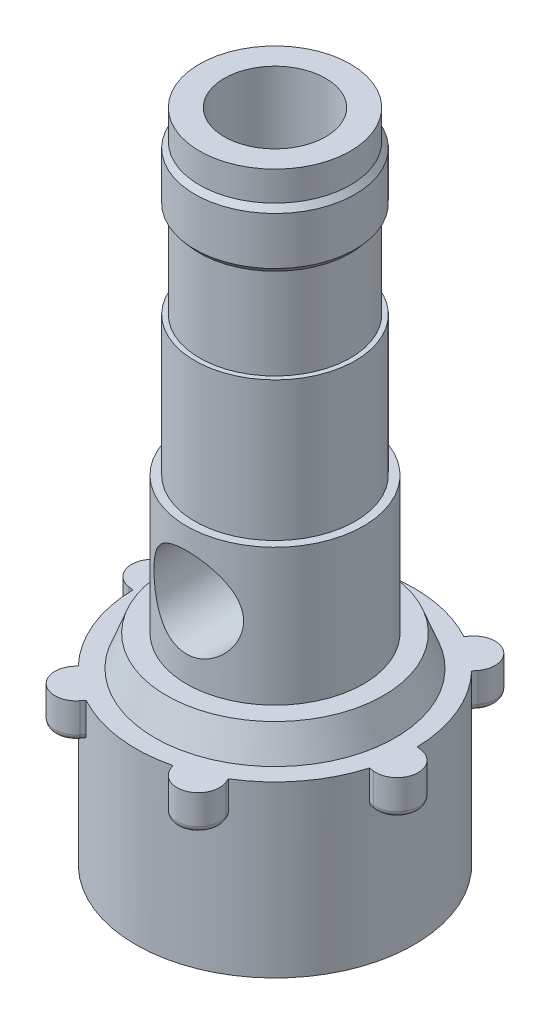
from build123d import *

# Parameters (mm, degrees)
CUT_EXTRUDE1_DEPTH              = 30.025161498
CUT_EXTRUDE1_DEPTH_BACK         = 30.025161498
SKETCH2_R                       = 1.9
BOSS_EXTRUDE3_DEPTH             = 1.5
FILLET1_RADIUS                  = 0.9
FILLET1_LENGTH                  = 1.5
FILLET2_R                       = 0.25
CIRPATTERN5_COUNT               = 6
FILLET1_OF_CIRPATTERN5_2_RADIUS = 0.9
FILLET1_OF_CIRPATTERN5_2_LENGTH = 1.5
FILLET1_OF_CIRPATTERN5_3_RADIUS = 0.9
FILLET1_OF_CIRPATTERN5_3_LENGTH = 1.5
FILLET1_OF_CIRPATTERN5_4_RADIUS = 0.9
FILLET1_OF_CIRPATTERN5_4_LENGTH = 1.5
FILLET1_OF_CIRPATTERN5_5_RADIUS = 0.9
FILLET1_OF_CIRPATTERN5_5_LENGTH = 1.5
FILLET1_OF_CIRPATTERN5_6_RADIUS = 0.9
FILLET1_OF_CIRPATTERN5_6_LENGTH = 1.5
FILLET3_R                       = 0.25


with BuildPart() as part:
    # Sketch1 → Revolve1 (revolve)
    with BuildSketch(Plane(origin=(0, 0, 0), x_dir=(0, 0, -1), z_dir=(1, 0, 0))):
        Polygon((0, 8), (3, 8), (3, 6), (5, 6), (5, 3), (5.3, 0), (5.9, 0), (5.9, 7.2), (5.1, 7.2), (4.6, 8.5), (3.75, 8.5), (3.75, 14.3), (3.4, 14.3), (3.4, 20.2), (3.2, 20.2), (3.2, 24.05), (3.4, 24.288350719), (3.4, 26.311649281), (3.2, 26.55), (3.2, 27.8), (2.15, 27.8), (2.15, 18.4), (1.9, 18.4), (1.9, 11.4), (0, 11.4), align=None)
    revolve(axis=Axis((0, 0, 0), (0, 1, 0)))

    # Sketch2 → Cut-Extrude1 (cut, two sides: drawn at the far end of the back side and taken through both)
    with BuildSketch(Plane.XY.offset(-CUT_EXTRUDE1_DEPTH_BACK)):
        with Locations((0, 11.5)):
            Circle(SKETCH2_R)
    extrude(amount=CUT_EXTRUDE1_DEPTH + CUT_EXTRUDE1_DEPTH_BACK, mode=Mode.SUBTRACT)

    # Sketch6 → Boss-Extrude3 (add)
    with BuildSketch(Plane(origin=(0, 7.2, 0), x_dir=(1, 0, 0), z_dir=(0, 1, 0))):
        Polygon((-3.477462054, 6.043522717), (-3.030086713, 4.963463101), (-1.367103554, 5.652293279), (-1.814478896, 6.732352896), align=None)
    boss_extrude3 = extrude(amount=-BOSS_EXTRUDE3_DEPTH)

    # Fillet1: full round fillet: the end face becomes a half cylinder, R = half its width
    fillet1_face = Plane((-2.645970475, 6.45, -6.387937807), x_dir=(0, 1, 0), z_dir=(-0.382683432365, 0, -0.923879532511))  # on the end face: x along it, z out of the body
    fillet1_slab = fillet1_face.offset(-FILLET1_RADIUS / 2) * Box(FILLET1_LENGTH, 2 * FILLET1_RADIUS, FILLET1_RADIUS, mode=Mode.PRIVATE)  # the body's end, R deep
    fillet1_round = Plane((-2.301555386, 6.45, -5.556446228), x_dir=(-0.382683432365, 0, -0.923879532511), z_dir=(0, 1, 0)) * Cylinder(FILLET1_RADIUS, FILLET1_LENGTH, mode=Mode.PRIVATE)  # its axis R under the face
    add(fillet1_slab - fillet1_round, mode=Mode.SUBTRACT)

    # Fillet2
    fillet2_edges = [part.edges().sort_by_distance(p)[0] for p in [
        (-3.097973615, 5.7, -5.12735658),
        (-2.645970475, 5.7, -6.387937807),
        (-1.434990456, 5.7, -5.816186758),
    ]]
    fillet(fillet2_edges, radius=FILLET2_R)

    # CirPattern5: Boss-Extrude3 ×6 about axis
    cirpattern5_axis = Axis((0, 0, 0), (0, 1, 0))
    for i in range(1, CIRPATTERN5_COUNT):
        add(boss_extrude3.rotate(cirpattern5_axis, i * 360 / CIRPATTERN5_COUNT))

    # Fillet1 of CirPattern5 2: full round fillet: the end face becomes a half cylinder, R = half its width
    fillet1_of_cirpattern5_2_face = Plane((-6.855101656, 6.45, -0.902491254), x_dir=(0, 1, 0), z_dir=(-0.991444861374, 0, -0.13052619222))  # on the end face: x along it, z out of the body
    fillet1_of_cirpattern5_2_slab = fillet1_of_cirpattern5_2_face.offset(-FILLET1_OF_CIRPATTERN5_2_RADIUS / 2) * Box(FILLET1_OF_CIRPATTERN5_2_LENGTH, 2 * FILLET1_OF_CIRPATTERN5_2_RADIUS, FILLET1_OF_CIRPATTERN5_2_RADIUS, mode=Mode.PRIVATE)  # the body's end, R deep
    fillet1_of_cirpattern5_2_round = Plane((-5.962801281, 6.45, -0.785017681), x_dir=(-0.991444861374, 0, -0.13052619222), z_dir=(0, 1, 0)) * Cylinder(FILLET1_OF_CIRPATTERN5_2_RADIUS, FILLET1_OF_CIRPATTERN5_2_LENGTH, mode=Mode.PRIVATE)  # its axis R under the face
    add(fillet1_of_cirpattern5_2_slab - fillet1_of_cirpattern5_2_round, mode=Mode.SUBTRACT)

    # Fillet1 of CirPattern5 3: full round fillet: the end face becomes a half cylinder, R = half its width
    fillet1_of_cirpattern5_3_face = Plane((-4.209131181, 6.45, 5.485446553), x_dir=(0, 1, 0), z_dir=(-0.608761429009, 0, 0.793353340291))  # on the end face: x along it, z out of the body
    fillet1_of_cirpattern5_3_slab = fillet1_of_cirpattern5_3_face.offset(-FILLET1_OF_CIRPATTERN5_3_RADIUS / 2) * Box(FILLET1_OF_CIRPATTERN5_3_LENGTH, 2 * FILLET1_OF_CIRPATTERN5_3_RADIUS, FILLET1_OF_CIRPATTERN5_3_RADIUS, mode=Mode.PRIVATE)  # the body's end, R deep
    fillet1_of_cirpattern5_3_round = Plane((-3.661245895, 6.45, 4.771428547), x_dir=(-0.608761429009, 0, 0.793353340291), z_dir=(0, 1, 0)) * Cylinder(FILLET1_OF_CIRPATTERN5_3_RADIUS, FILLET1_OF_CIRPATTERN5_3_LENGTH, mode=Mode.PRIVATE)  # its axis R under the face
    add(fillet1_of_cirpattern5_3_slab - fillet1_of_cirpattern5_3_round, mode=Mode.SUBTRACT)

    # Fillet1 of CirPattern5 4: full round fillet: the end face becomes a half cylinder, R = half its width
    fillet1_of_cirpattern5_4_face = Plane((2.645970475, 6.45, 6.387937807), x_dir=(0, 1, 0), z_dir=(0.382683432365, 0, 0.923879532511))  # on the end face: x along it, z out of the body
    fillet1_of_cirpattern5_4_slab = fillet1_of_cirpattern5_4_face.offset(-FILLET1_OF_CIRPATTERN5_4_RADIUS / 2) * Box(FILLET1_OF_CIRPATTERN5_4_LENGTH, 2 * FILLET1_OF_CIRPATTERN5_4_RADIUS, FILLET1_OF_CIRPATTERN5_4_RADIUS, mode=Mode.PRIVATE)  # the body's end, R deep
    fillet1_of_cirpattern5_4_round = Plane((2.301555386, 6.45, 5.556446228), x_dir=(0.382683432365, 0, 0.923879532511), z_dir=(0, 1, 0)) * Cylinder(FILLET1_OF_CIRPATTERN5_4_RADIUS, FILLET1_OF_CIRPATTERN5_4_LENGTH, mode=Mode.PRIVATE)  # its axis R under the face
    add(fillet1_of_cirpattern5_4_slab - fillet1_of_cirpattern5_4_round, mode=Mode.SUBTRACT)

    # Fillet1 of CirPattern5 5: full round fillet: the end face becomes a half cylinder, R = half its width
    fillet1_of_cirpattern5_5_face = Plane((6.855101656, 6.45, 0.902491254), x_dir=(0, 1, 0), z_dir=(0.991444861374, 0, 0.13052619222))  # on the end face: x along it, z out of the body
    fillet1_of_cirpattern5_5_slab = fillet1_of_cirpattern5_5_face.offset(-FILLET1_OF_CIRPATTERN5_5_RADIUS / 2) * Box(FILLET1_OF_CIRPATTERN5_5_LENGTH, 2 * FILLET1_OF_CIRPATTERN5_5_RADIUS, FILLET1_OF_CIRPATTERN5_5_RADIUS, mode=Mode.PRIVATE)  # the body's end, R deep
    fillet1_of_cirpattern5_5_round = Plane((5.962801281, 6.45, 0.785017681), x_dir=(0.991444861374, 0, 0.13052619222), z_dir=(0, 1, 0)) * Cylinder(FILLET1_OF_CIRPATTERN5_5_RADIUS, FILLET1_OF_CIRPATTERN5_5_LENGTH, mode=Mode.PRIVATE)  # its axis R under the face
    add(fillet1_of_cirpattern5_5_slab - fillet1_of_cirpattern5_5_round, mode=Mode.SUBTRACT)

    # Fillet1 of CirPattern5 6: full round fillet: the end face becomes a half cylinder, R = half its width
    fillet1_of_cirpattern5_6_face = Plane((4.209131181, 6.45, -5.485446553), x_dir=(0, 1, 0), z_dir=(0.608761429009, 0, -0.793353340291))  # on the end face: x along it, z out of the body
    fillet1_of_cirpattern5_6_slab = fillet1_of_cirpattern5_6_face.offset(-FILLET1_OF_CIRPATTERN5_6_RADIUS / 2) * Box(FILLET1_OF_CIRPATTERN5_6_LENGTH, 2 * FILLET1_OF_CIRPATTERN5_6_RADIUS, FILLET1_OF_CIRPATTERN5_6_RADIUS, mode=Mode.PRIVATE)  # the body's end, R deep
    fillet1_of_cirpattern5_6_round = Plane((3.661245895, 6.45, -4.771428547), x_dir=(0.608761429009, 0, -0.793353340291), z_dir=(0, 1, 0)) * Cylinder(FILLET1_OF_CIRPATTERN5_6_RADIUS, FILLET1_OF_CIRPATTERN5_6_LENGTH, mode=Mode.PRIVATE)  # its axis R under the face
    add(fillet1_of_cirpattern5_6_slab - fillet1_of_cirpattern5_6_round, mode=Mode.SUBTRACT)

    # Fillet3
    fillet3_edges = [part.edges().sort_by_distance(p)[0] for p in [
        (-5.754460714, 5.7, -1.66535519),
        (-4.319470258, 5.7, 4.150831569),
        (1.434990456, 5.7, 5.816186758),
        (5.754460714, 5.7, 1.66535519),
        (4.319470258, 5.7, -4.150831569),
        (-5.98940786, 5.7, 0.119245561),
        (-6.855101656, 5.7, -0.902491254),
        (-2.891434245, 5.7, 5.246602141),
        (-4.209131181, 5.7, 5.485446553),
        (3.097973615, 5.7, 5.12735658),
        (2.645970475, 5.7, 6.387937807),
        (5.98940786, 5.7, -0.119245561),
        (6.855101656, 5.7, 0.902491254),
        (2.891434245, 5.7, -5.246602141),
        (4.209131181, 5.7, -5.485446553),
    ]]
    fillet(fillet3_edges, radius=FILLET3_R)


solid = part.part
